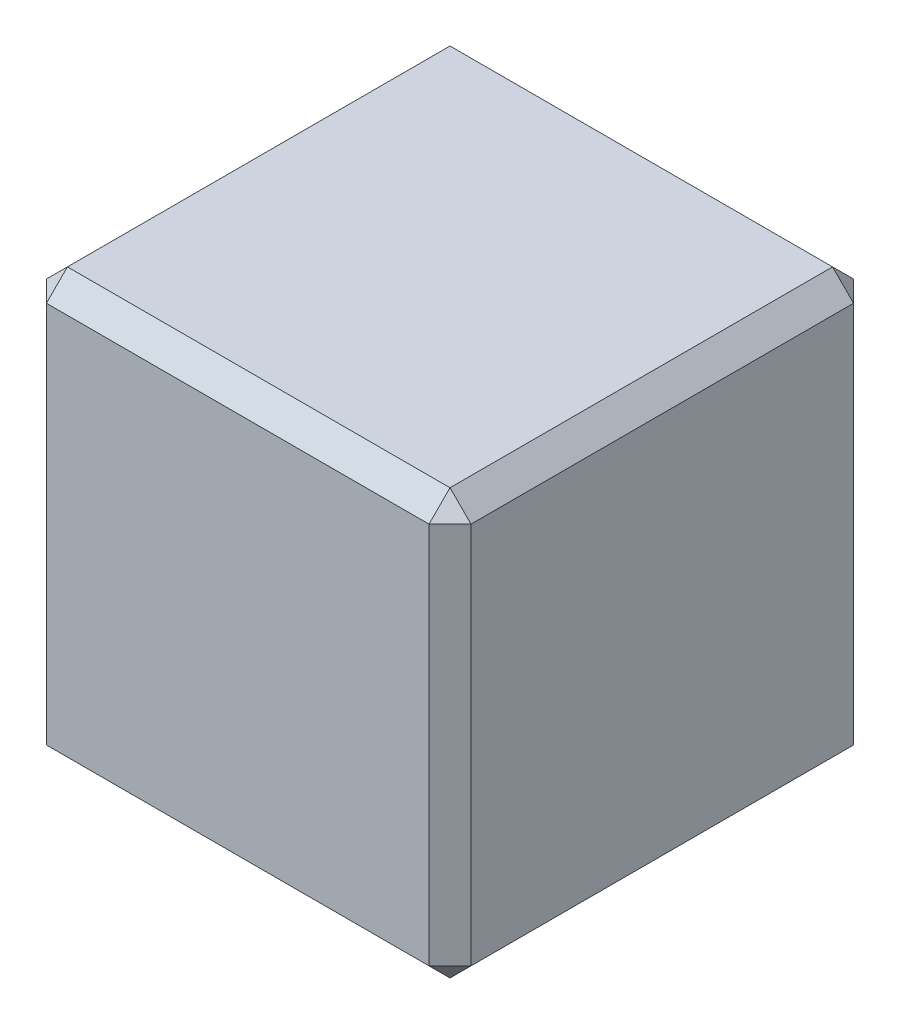
from build123d import *

# Parameters (mm, degrees)
SKETCH_1_W      = 101.08
SKETCH_1_H      = 101.08
EXTRUDE_1_DEPTH = 101.08
CHAMFER_1_SIZE  = 5


with BuildPart() as part:
    # 草图1 → 凸台-拉伸1 (new body)
    with BuildSketch(Plane(origin=(0, 0, 0), x_dir=(1, 0, 0), z_dir=(0, 1, 0))):
        Rectangle(SKETCH_1_W, SKETCH_1_H)
    extrude(amount=EXTRUDE_1_DEPTH)

    # 倒角1
    chamfer_1_edges = [part.edges().sort_by_distance(p)[0] for p in [
        (-50.54, 101.08, 0),
        (0, 101.08, 50.54),
        (50.54, 101.08, 0),
        (0, 0, 50.54),
        (-50.54, 0, 0),
        (0, 0, -50.54),
        (50.54, 0, 0),
        (0, 101.08, -50.54),
        (50.54, 50.54, 50.54),
        (-50.54, 50.54, 50.54),
        (-50.54, 50.54, -50.54),
        (50.54, 50.54, -50.54),
    ]]
    chamfer(chamfer_1_edges, length=CHAMFER_1_SIZE)


solid = part.part
